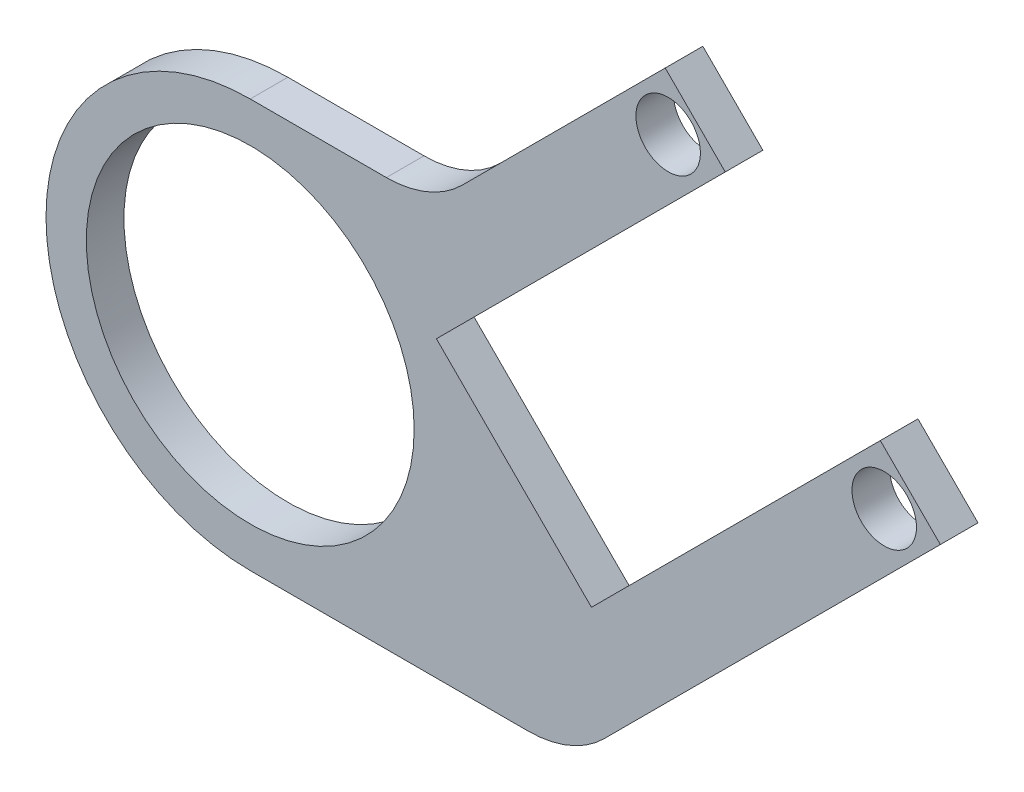
from build123d import *

# Parameters (mm, degrees)
SKETCH1_R           = 2.5
BOSS_EXTRUDE1_DEPTH = 3.5
SKETCH2_R           = 1.5
CUT_EXTRUDE1_DEPTH  = 77.148499601
FILLET1_R           = 10
SKETCH5_R           = 15.25
SKETCH5_R_2         = 3
CUT_EXTRUDE4_DEPTH  = 77.148499601


with BuildPart() as part:
    # Sketch1 → Boss-Extrude1 (new body)
    with BuildSketch(Plane.XY):
        with BuildLine():
            Line((0, -19), (30, -19))
            Line((30, -19), (64.201367261, 15.201367261))
            Line((64.201367261, 15.201367261), (58.615223689, 20.787510832))
            Line((58.615223689, 20.787510832), (31.745166004, -6.082546853))
            Line((31.745166004, -6.082546853), (17.320187668, 8.342431483))
            Line((17.320187668, 8.342431483), (44.190245353, 35.212489168))
            Line((44.190245353, 35.212489168), (38.604101782, 40.798632739))
            Line((38.604101782, 40.798632739), (16.805469042, 19))
            Line((16.805469042, 19), (0, 19))
            ThreePointArc((0, 19), (-19, 0), (0, -19))
        make_face()
        Circle(SKETCH1_R, mode=Mode.SUBTRACT)
    extrude(amount=BOSS_EXTRUDE1_DEPTH)

    # Sketch2 → Cut-Extrude1 (cut, through all)
    with BuildSketch(Plane.XY.offset(3.5)):
        with Locations((38.878105659, 35.574881393)):
            Circle(SKETCH2_R)
        with Locations((58.977615915, 15.475371138)):
            Circle(SKETCH2_R)
    extrude(amount=-CUT_EXTRUDE1_DEPTH, mode=Mode.SUBTRACT)

    # Fillet1
    fillet1_edges = [part.edges().sort_by_distance(p)[0] for p in [
        (16.805469042, 19, 1.75),
        (30, -19, 1.75),
    ]]
    fillet(fillet1_edges, radius=FILLET1_R)

    # Sketch5 → Cut-Extrude4 (cut, through all)
    with BuildSketch(Plane.XY.offset(3.5)):
        Circle(SKETCH5_R)
        with Locations((38.878105659, 35.574881393)):
            Circle(SKETCH5_R_2)
        with Locations((58.977615915, 15.475371138)):
            Circle(SKETCH5_R_2)
    extrude(amount=-CUT_EXTRUDE4_DEPTH, mode=Mode.SUBTRACT)


solid = part.part
